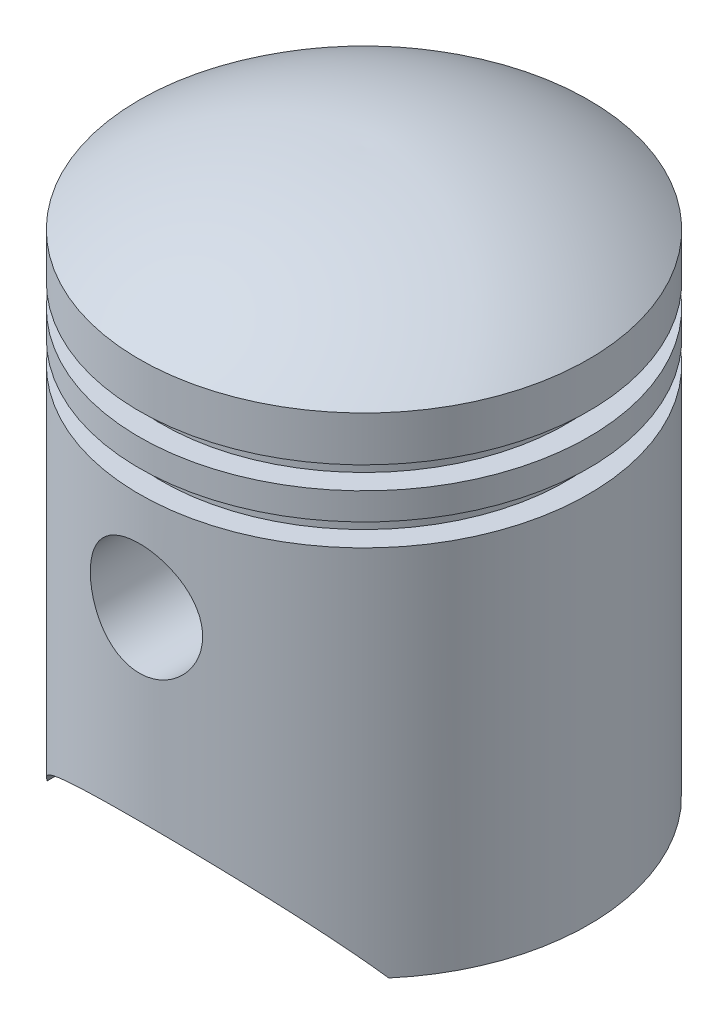
from build123d import *

# Parameters (mm, degrees)
CUT_EXTRUDE1_DEPTH       = 72.817566835
CUT_EXTRUDE1_DEPTH_BACK  = 72.817566835
SKETCH4_R                = 6.25
BOSS_EXTRUDE1_REACH      = 85.818
BOSS_EXTRUDE1_END_RADIUS = 23
BOSS_EXTRUDE1_START      = 12
SKETCH5_R                = 7.25
SKETCH5_R_2              = 6.25


with BuildPart() as part:
    # Sketch3 → Revolve1 (revolve)
    with BuildSketch(Plane.XY, mode=Mode.PRIVATE) as revolve1_sk:
        with BuildLine():
            Line((25, 0), (25, 41.5))
            Line((25, 41.5), (22.5, 41.5))
            Line((22.5, 41.5), (22.5, 44))
            Line((22.5, 44), (25, 44))
            Line((25, 44), (25, 47))
            Line((25, 47), (22.5, 47))
            Line((22.5, 47), (22.5, 49.5))
            Line((22.5, 49.5), (25, 49.5))
            Line((25, 49.5), (25, 54.5))
            ThreePointArc((25, 54.5), (13.174901691, 60.609067785), (0, 62.5))
            Line((0, 62.5), (0, 60.49936285))
            ThreePointArc((0, 60.49936285), (12.069492637, 58.859165445), (23, 53.484511145))
            Line((23, 53.484511145), (23, 51.5))
            Line((23, 51.5), (20.5, 51.5))
            Line((20.5, 51.5), (20.5, 45.5))
            Line((20.5, 45.5), (20.5, 39.5))
            Line((20.5, 39.5), (23, 39.5))
            Line((23, 39.5), (23, 0))
            Line((23, 0), (25, 0))
        make_face()
    revolve(revolve1_sk.sketch.rotate(Axis((0, 62.5, 0), (0, -1, 0)), 180), axis=Axis((0, 62.5, 0), (0, -1, 0)))

    # Sketch4 → Cut-Extrude1 (cut, two sides: drawn at the far end of the back side and taken through both)
    with BuildSketch(Plane.XY.offset(-CUT_EXTRUDE1_DEPTH_BACK)):
        with Locations((0, 30.5)):
            Circle(SKETCH4_R)
        with BuildLine():
            Line((-19, 0), (19, 0))
            ThreePointArc((19, 0), (0, 10), (-19, 0))
        make_face()
    extrude(amount=CUT_EXTRUDE1_DEPTH + CUT_EXTRUDE1_DEPTH_BACK, mode=Mode.SUBTRACT)

    # Boss-Extrude1: up to this cylinder (the profile starts inside it)
    boss_extrude1_end = Plane(origin=(0, 30.5, 0), z_dir=(0, 1, 0)) * Cylinder(BOSS_EXTRUDE1_END_RADIUS, 218.636, mode=Mode.PRIVATE)
    # Sketch5 → Boss-Extrude1 (add, up to the surface)
    with BuildSketch(Plane.XY.offset(BOSS_EXTRUDE1_START), mode=Mode.PRIVATE) as boss_extrude1_sk1:
        with Locations(Location((0, 30.5, 0), (0, 0, 180))):
            Circle(SKETCH5_R)
        with Locations((0, 30.5)):
            Circle(SKETCH5_R_2, mode=Mode.SUBTRACT)
    boss_extrude1_tool1 = extrude(boss_extrude1_sk1.sketch, amount=BOSS_EXTRUDE1_REACH, mode=Mode.PRIVATE) & boss_extrude1_end
    boss_extrude1 = boss_extrude1_tool1.solids().sort_by_distance((7.044939, 30.5, 12))[0]
    add(boss_extrude1)

    # Mirror1: Boss-Extrude1 across plane
    add(boss_extrude1.mirror(Plane.XY))


solid = part.part
